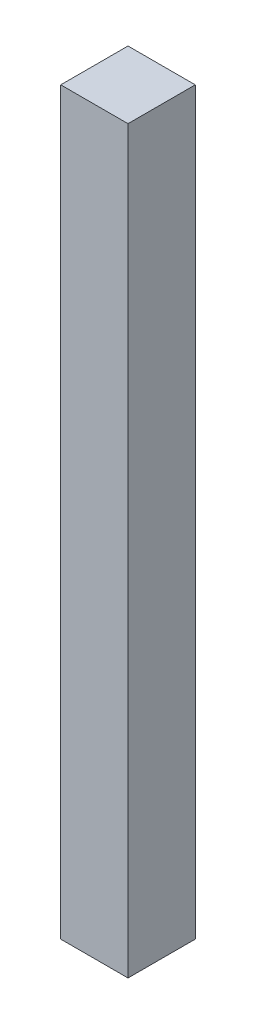
from build123d import *

# Parameters (mm, degrees)
SKETCH_1_W      = 20
SKETCH_1_H      = 20
EXTRUDE_1_DEPTH = 220


with BuildPart() as part:
    # 草圖1 → 填料-伸長1 (new body)
    with BuildSketch(Plane(origin=(0, 0, 0), x_dir=(1, 0, 0), z_dir=(0, 1, 0))):
        Rectangle(SKETCH_1_W, SKETCH_1_H)
    extrude(amount=EXTRUDE_1_DEPTH)


solid = part.part
